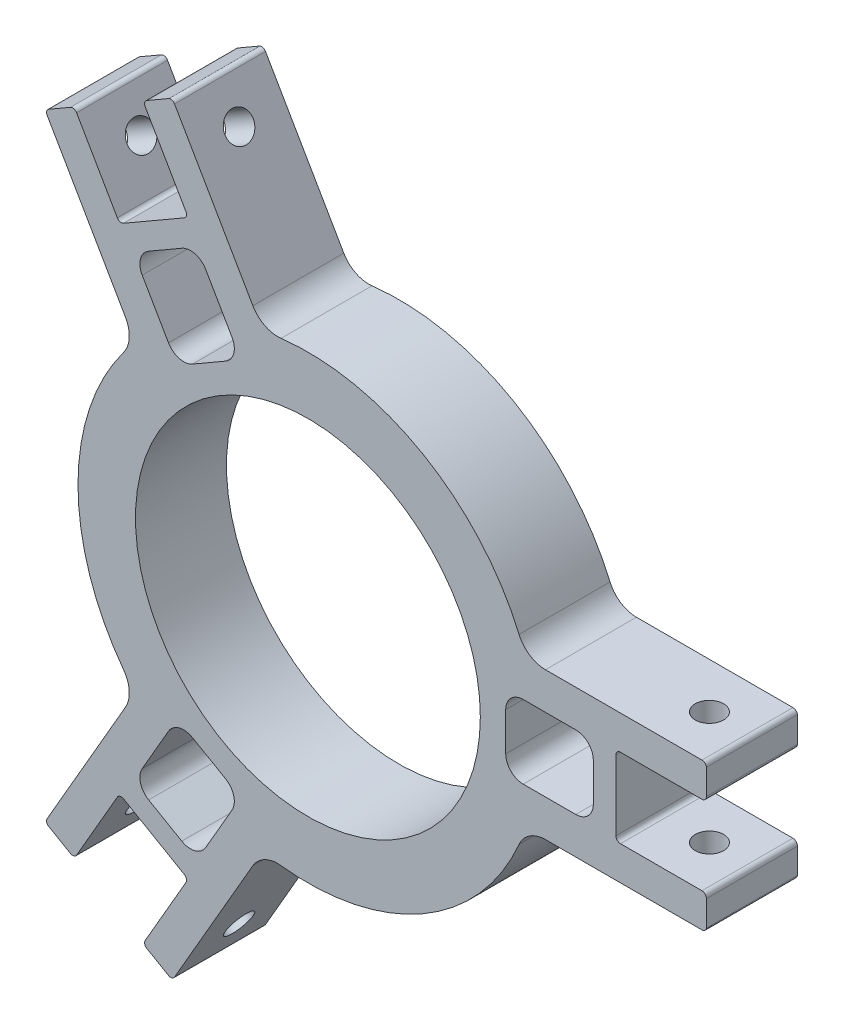
from build123d import *

# Parameters (mm, degrees)
SKETCH1_R           = 38.1
BOSS_EXTRUDE1_DEPTH = 20.1
SKETCH4_R           = 3.125
CUT_EXTRUDE3_DEPTH  = 134.421728778
SKETCH6_R           = 3.125
CUT_EXTRUDE4_DEPTH  = 134.889662183
SKETCH7_R           = 3.125
CUT_EXTRUDE5_DEPTH  = 154.333276804


with BuildPart() as part:
    # Sketch1 → Boss-Extrude1 (new body)
    with BuildSketch(Plane.XY):
        with BuildLine():
            Line((-87.199197341, 83.680917653), (-92.083580619, 80.860917653))
            ThreePointArc((-92.083580619, 80.860917653), (-92.549506445, 80.253711294), (-92.449606022, 79.494892249))
            Line((-92.449606022, 79.494892249), (-83.449606022, 63.906434981))
            ThreePointArc((-83.449606022, 63.906434981), (-83.3497056, 63.147615936), (-83.815631426, 62.540409577))
            Line((-83.815631426, 62.540409577), (-97.240798671, 54.789385655))
            ThreePointArc((-97.240798671, 54.789385655), (-97.999617716, 54.689485232), (-98.606824075, 55.155411058))
            Line((-98.606824075, 55.155411058), (-107.606824075, 70.743868326))
            ThreePointArc((-107.606824075, 70.743868326), (-108.214030434, 71.209794153), (-108.972849479, 71.10989373))
            Line((-108.972849479, 71.10989373), (-113.857232756, 68.28989373))
            ThreePointArc((-113.857232756, 68.28989373), (-114.221904453, 67.692926638), (-114.106124766, 67.003035183))
            Line((-114.106124766, 67.003035183), (-96.816210848, 37.056025818))
            ThreePointArc((-96.816210848, 37.056025818), (-95.976342212, 33.509634544), (-97.224589096, 30.085579914))
            ThreePointArc((-97.224589096, 30.085579914), (-107.297524567, -0.277987315), (-97.224589096, -30.641554544))
            ThreePointArc((-97.224589096, -30.641554544), (-95.976342212, -34.065609174), (-96.816210848, -37.612000448))
            Line((-96.816210848, -37.612000448), (-114.106124766, -67.559009813))
            ThreePointArc((-114.106124766, -67.559009813), (-114.221904453, -68.248901268), (-113.857232756, -68.84586836))
            Line((-113.857232756, -68.84586836), (-108.972849479, -71.66586836))
            ThreePointArc((-108.972849479, -71.66586836), (-108.214030434, -71.765768783), (-107.606824075, -71.299842956))
            Line((-107.606824075, -71.299842956), (-98.606824075, -55.711385688))
            ThreePointArc((-98.606824075, -55.711385688), (-97.999617716, -55.245459862), (-97.240798671, -55.345360285))
            Line((-97.240798671, -55.345360285), (-83.815631426, -63.096384207))
            ThreePointArc((-83.815631426, -63.096384207), (-83.3497056, -63.703590566), (-83.449606022, -64.462409611))
            Line((-83.449606022, -64.462409611), (-92.449606022, -80.050866879))
            ThreePointArc((-92.449606022, -80.050866879), (-92.549506445, -80.809685924), (-92.083580619, -81.416892283))
            Line((-92.083580619, -81.416892283), (-87.199197341, -84.236892283))
            ThreePointArc((-87.199197341, -84.236892283), (-86.499872826, -84.25422369), (-85.960299143, -83.809009813))
            Line((-85.960299143, -83.809009813), (-68.670385225, -53.862000448))
            ThreePointArc((-68.670385225, -53.862000448), (-66.019054608, -51.361457236), (-62.429612873, -50.730443433))
            ThreePointArc((-62.429612873, -50.730443433), (-31.097524567, -44.272077827), (-9.838371733, -20.366876204))
            ThreePointArc((-9.838371733, -20.366876204), (-7.497176881, -17.573835377), (-4.005977629, -16.527987315))
            Line((-4.005977629, -16.527987315), (30.573850208, -16.527987315))
            ThreePointArc((30.573850208, -16.527987315), (31.229203577, -16.283309737), (31.563856396, -15.669011238))
            Line((31.563856396, -15.669011238), (31.563856396, -10.029011238))
            ThreePointArc((31.563856396, -10.029011238), (31.270963178, -9.321904457), (30.563856396, -9.029011238))
            Line((30.563856396, -9.029011238), (12.563856396, -9.029011238))
            ThreePointArc((12.563856396, -9.029011238), (11.856749615, -8.736118019), (11.563856396, -8.029011238))
            Line((11.563856396, -8.029011238), (11.563856396, 7.473036608))
            ThreePointArc((11.563856396, 7.473036608), (11.856749615, 8.180143389), (12.563856396, 8.473036608))
            Line((12.563856396, 8.473036608), (30.563856396, 8.473036608))
            ThreePointArc((30.563856396, 8.473036608), (31.270963178, 8.765929827), (31.563856396, 9.473036608))
            Line((31.563856396, 9.473036608), (31.563856396, 15.113036608))
            ThreePointArc((31.563856396, 15.113036608), (31.229203577, 15.727335107), (30.573850208, 15.972012685))
            Line((30.573850208, 15.972012685), (-4.005977629, 15.972012685))
            ThreePointArc((-4.005977629, 15.972012685), (-7.497176881, 17.017860747), (-9.838371733, 19.810901574))
            ThreePointArc((-9.838371733, 19.810901574), (-31.097524567, 43.716103197), (-62.429612873, 50.174468803))
            ThreePointArc((-62.429612873, 50.174468803), (-66.019054608, 50.805482606), (-68.670385225, 53.306025818))
            Line((-68.670385225, 53.306025818), (-85.960299143, 83.253035183))
            ThreePointArc((-85.960299143, 83.253035183), (-86.499872826, 83.69824906), (-87.199197341, 83.680917653))
        make_face()
        with BuildLine():
            ThreePointArc((-91.68717238, -52.778245227), (-93.492634957, -50.425320587), (-93.105520819, -47.484896787))
            Line((-93.105520819, -47.484896787), (-87.30204773, -37.432986536))
            ThreePointArc((-87.30204773, -37.432986536), (-84.94912309, -35.627523959), (-82.00869929, -36.014638096))
            Line((-82.00869929, -36.014638096), (-74.690784628, -40.239638096))
            ThreePointArc((-74.690784628, -40.239638096), (-72.885322051, -42.592562736), (-73.272436189, -45.532986536))
            Line((-73.272436189, -45.532986536), (-79.075909278, -55.584896787))
            ThreePointArc((-79.075909278, -55.584896787), (-81.428833918, -57.390359364), (-84.369257718, -57.003245227))
            Line((-84.369257718, -57.003245227), (-91.68717238, -52.778245227))
        make_face(mode=Mode.SUBTRACT)
        with Locations((-56.497524567, -0.277987315)):
            Circle(SKETCH1_R, mode=Mode.SUBTRACT)
        with BuildLine():
            Line((-74.690784628, 39.683663466), (-82.00869929, 35.458663466))
            ThreePointArc((-82.00869929, 35.458663466), (-84.94912309, 35.071549329), (-87.30204773, 36.877011906))
            Line((-87.30204773, 36.877011906), (-93.105520819, 46.928922157))
            ThreePointArc((-93.105520819, 46.928922157), (-93.492634957, 49.869345957), (-91.68717238, 52.222270597))
            Line((-91.68717238, 52.222270597), (-84.369257718, 56.447270597))
            ThreePointArc((-84.369257718, 56.447270597), (-81.428833918, 56.834384734), (-79.075909278, 55.028922157))
            Line((-79.075909278, 55.028922157), (-73.272436189, 44.977011906))
            ThreePointArc((-73.272436189, 44.977011906), (-72.885322051, 42.036588106), (-74.690784628, 39.683663466))
        make_face(mode=Mode.SUBTRACT)
        with BuildLine():
            ThreePointArc((6.563856396, -4.502987315), (5.428895173, -7.243026092), (2.688856396, -8.377987315))
            Line((2.688856396, -8.377987315), (-8.918089783, -8.377987315))
            ThreePointArc((-8.918089783, -8.377987315), (-11.65812856, -7.243026092), (-12.793089783, -4.502987315))
            Line((-12.793089783, -4.502987315), (-12.793089783, 3.947012685))
            ThreePointArc((-12.793089783, 3.947012685), (-11.65812856, 6.687051462), (-8.918089783, 7.822012685))
            Line((-8.918089783, 7.822012685), (2.688856396, 7.822012685))
            ThreePointArc((2.688856396, 7.822012685), (5.428895173, 6.687051462), (6.563856396, 3.947012685))
            Line((6.563856396, 3.947012685), (6.563856396, -4.502987315))
        make_face(mode=Mode.SUBTRACT)
    extrude(amount=BOSS_EXTRUDE1_DEPTH)

    # Sketch4 → Cut-Extrude3 (cut, through all)
    with BuildSketch(Plane(origin=(-28.420602652, -16.408642592, 0), x_dir=(0, 0, -1), z_dir=(0.8660254037844387, 0.49999999999999983, 0))):
        with Locations(Location((-10.05, 106.679392982, 0), (0, 0, 90))):
            Circle(SKETCH4_R)
    extrude(amount=-CUT_EXTRUDE3_DEPTH, mode=Mode.SUBTRACT)

    # Sketch6 → Cut-Extrude4 (cut, through all)
    with BuildSketch(Plane(origin=(-28.179858575, 16.269648934, 0), x_dir=(0, 0, -1), z_dir=(0.8660254037844342, -0.5000000000000079, 0))):
        with Locations(Location((-10.05, -107.160881135, 0), (0, 0, 90))):
            Circle(SKETCH6_R)
    extrude(amount=-CUT_EXTRUDE4_DEPTH, mode=Mode.SUBTRACT)

    # Sketch7 → Cut-Extrude5 (cut, through all)
    with BuildSketch(Plane(origin=(0, 15.972012685, 0), x_dir=(1, 0, 0), z_dir=(0, 1, 0))):
        with Locations(Location((22.173850208, -10.05, 0), (0, 0, 180))):
            Circle(SKETCH7_R)
    extrude(amount=-CUT_EXTRUDE5_DEPTH, mode=Mode.SUBTRACT)


solid = part.part
